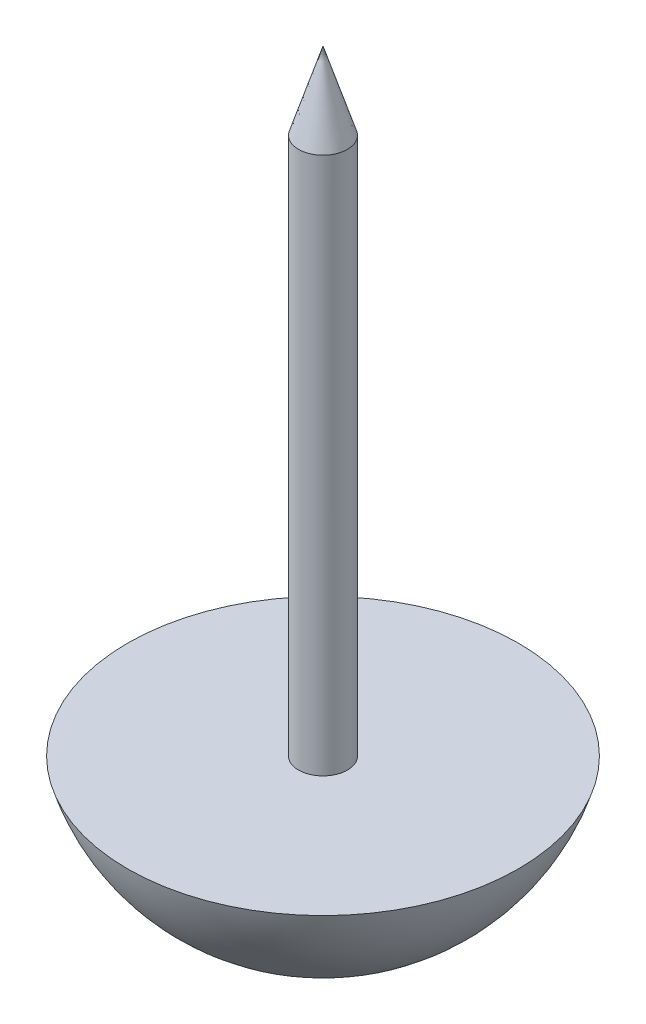
from build123d import *


with BuildPart() as part:
    # Sketch1 → Revolve1 (revolve)
    with BuildSketch(Plane(origin=(0, 0, 0), x_dir=(0, 0, -1), z_dir=(1, 0, 0))):
        with BuildLine():
            Line((0, 19.974260589), (0, -4.7625))
            ThreePointArc((0, -4.7625), (3.96875, -3.439583333), (6.35, 0))
            Line((6.35, 0), (0.79375, 0))
            Line((0.79375, 0), (0.79375, 17.4625))
            Line((0.79375, 17.4625), (0, 19.974260589))
        make_face()
    revolve(axis=Axis((0, 26.794732143, 0), (0, -1, 0)))


solid = part.part
